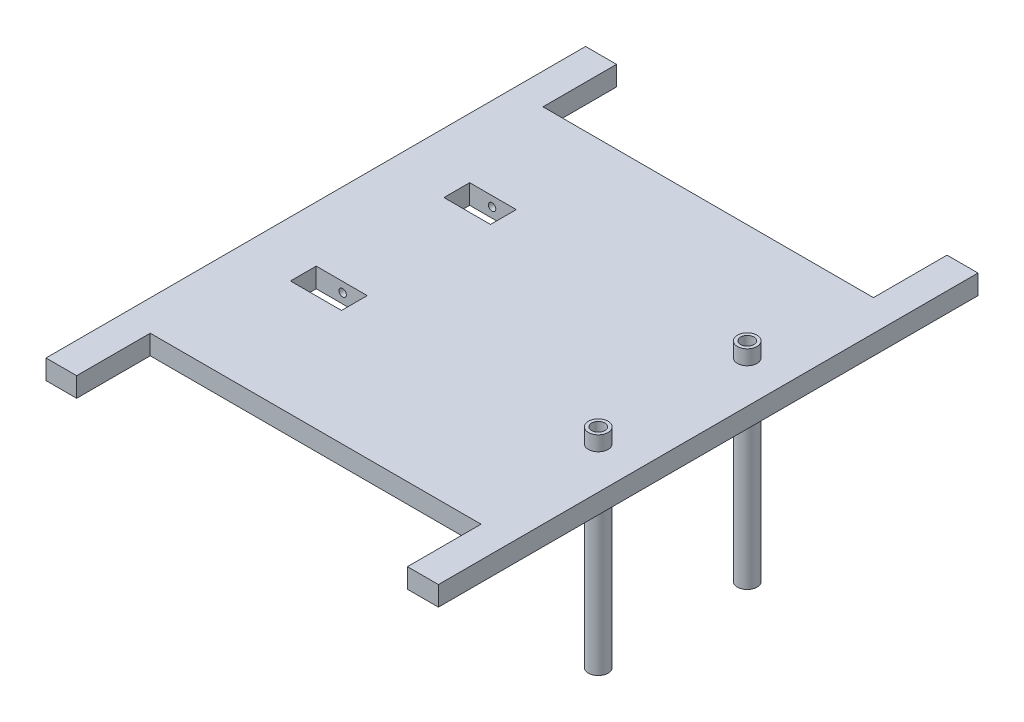
from build123d import *

# Parameters (mm, degrees)
SKETCH1_W           = 160
SKETCH1_H           = 8
BOSS_EXTRUDE1_DEPTH = 160
SKETCH2_W           = 12.5
SKETCH2_H           = 8
BOSS_EXTRUDE2_DEPTH = 30
SKETCH3_W           = 12.63
SKETCH3_H           = 8
BOSS_EXTRUDE3_DEPTH = 30
SKETCH4_W           = 12.63
SKETCH4_H           = 8
BOSS_EXTRUDE4_DEPTH = 30
SKETCH5_W           = 12.63
SKETCH5_H           = 8
BOSS_EXTRUDE5_DEPTH = 30
SKETCH6_W           = 19
SKETCH6_H           = 10.5
SKETCH6_W_2         = 20.818922979
CUT_EXTRUDE1_DEPTH  = 10
SKETCH8_R           = 1.5
CUT_EXTRUDE4_DEPTH  = 25
SKETCH9_R           = 1.5
CUT_EXTRUDE5_DEPTH  = 25
BOSS_EXTRUDE6_START = 10
SKETCH10_R          = 4
BOSS_EXTRUDE6_DEPTH = 85
SKETCH13_R          = 2.7
CUT_EXTRUDE6_DEPTH  = 85
SKETCH14_R          = 2.7
CUT_EXTRUDE7_DEPTH  = 85


with BuildPart() as part:
    # Sketch1 → Boss-Extrude1 (new body)
    with BuildSketch(Plane(origin=(0, 0, 0), x_dir=(0, 0, -1), z_dir=(1, 0, 0))):
        Rectangle(SKETCH1_W, SKETCH1_H)
    extrude(amount=BOSS_EXTRUDE1_DEPTH)

    # Sketch2 → Boss-Extrude2 (add)
    with BuildSketch(Plane.XY.offset(80)):
        with Locations((6.25, 0)):
            Rectangle(SKETCH2_W, SKETCH2_H)
    extrude(amount=BOSS_EXTRUDE2_DEPTH)

    # Sketch3 → Boss-Extrude3 (add)
    with BuildSketch(Plane.XY.offset(80)):
        with Locations((153.685, 0)):
            Rectangle(SKETCH3_W, SKETCH3_H)
    extrude(amount=BOSS_EXTRUDE3_DEPTH)

    # Sketch4 → Boss-Extrude4 (add)
    with BuildSketch(Plane(origin=(0, 0, -80), x_dir=(-1, 0, 0), z_dir=(0, 0, -1))):
        with Locations((-153.685, 0)):
            Rectangle(SKETCH4_W, SKETCH4_H)
    extrude(amount=BOSS_EXTRUDE4_DEPTH)

    # Sketch5 → Boss-Extrude5 (add)
    with BuildSketch(Plane(origin=(0, 0, -80), x_dir=(-1, 0, 0), z_dir=(0, 0, -1))):
        with Locations((-6.315, 0)):
            Rectangle(SKETCH5_W, SKETCH5_H)
    extrude(amount=BOSS_EXTRUDE5_DEPTH)

    # Sketch6 → Cut-Extrude1 (cut)
    with BuildSketch(Plane(origin=(0, 4, 0), x_dir=(1, 0, 0), z_dir=(0, 1, 0))):
        with Locations((33.96830463, 33.015847685)):
            Rectangle(SKETCH6_W, SKETCH6_H)
        with Locations((33.058843141, -27.73153178)):
            Rectangle(SKETCH6_W_2, SKETCH6_H)
    extrude(amount=-CUT_EXTRUDE1_DEPTH, mode=Mode.SUBTRACT)

    # Sketch8 → Cut-Extrude4 (cut, symmetric)
    with BuildSketch(Plane.XY.offset(-38.265847685)):
        with Locations((33.619205895, 0)):
            Circle(SKETCH8_R)
    extrude(amount=CUT_EXTRUDE4_DEPTH, both=True, mode=Mode.SUBTRACT)

    # Sketch9 → Cut-Extrude5 (cut, symmetric)
    with BuildSketch(Plane.XY.offset(22.48153178)):
        with Locations((33.446786586, 0)):
            Circle(SKETCH9_R)
    extrude(amount=CUT_EXTRUDE5_DEPTH, both=True, mode=Mode.SUBTRACT)

    # Sketch10 → Boss-Extrude6 (add)
    with BuildSketch(Plane(origin=(0, 0, 0), x_dir=(1, 0, 0), z_dir=(0, 1, 0)).offset(BOSS_EXTRUDE6_START)):
        with Locations(Location((142.895014093, -27.73153178, 0), (0, 0, 270))):
            Circle(SKETCH10_R)
        with Locations(Location((142.895014093, 33.015847685, 0), (0, 0, 270))):
            Circle(SKETCH10_R)
    extrude(amount=-BOSS_EXTRUDE6_DEPTH)

    # Sketch13 → Cut-Extrude6 (cut)
    with BuildSketch(Plane(origin=(0, 10, 0), x_dir=(1, 0, 0), z_dir=(0, 1, 0))):
        with Locations(Location((142.895014093, -27.73153178, 0), (0, 0, 270))):
            Circle(SKETCH13_R)
    extrude(amount=-CUT_EXTRUDE6_DEPTH, mode=Mode.SUBTRACT)

    # Sketch14 → Cut-Extrude7 (cut)
    with BuildSketch(Plane(origin=(0, 10, 0), x_dir=(1, 0, 0), z_dir=(0, 1, 0))):
        with Locations(Location((142.895014093, 33.015847685, 0), (0, 0, 270))):
            Circle(SKETCH14_R)
    extrude(amount=-CUT_EXTRUDE7_DEPTH, mode=Mode.SUBTRACT)


solid = part.part
